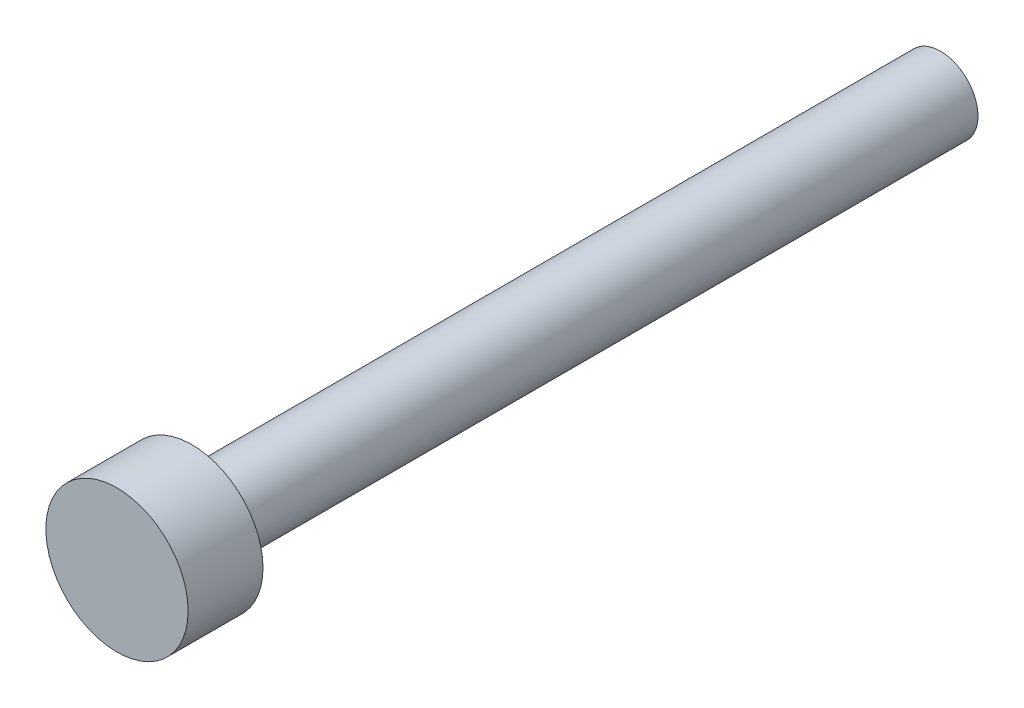
from build123d import *

# Parameters (mm, degrees)
SHANK_NOMINAL_THREAD_ENVELOPE_START     = -20
SHANK_NOMINAL_THREAD_ENVELOPE_PROFILE_R = 1
SHANK_NOMINAL_THREAD_ENVELOPE_DEPTH     = 20
SOCKET_HEAD_ENVELOPE_PROFILE_R          = 1.9
SOCKET_HEAD_ENVELOPE_DEPTH              = 2


with BuildPart() as part:
    # Shank_nominal_thread_envelope_profile → Shank_nominal_thread_envelope (new body)
    with BuildSketch(Plane.XY.offset(SHANK_NOMINAL_THREAD_ENVELOPE_START)):
        Circle(SHANK_NOMINAL_THREAD_ENVELOPE_PROFILE_R)
    extrude(amount=SHANK_NOMINAL_THREAD_ENVELOPE_DEPTH)

    # Socket_head_envelope_profile → Socket_head_envelope (add)
    with BuildSketch(Plane.XY):
        Circle(SOCKET_HEAD_ENVELOPE_PROFILE_R)
    extrude(amount=SOCKET_HEAD_ENVELOPE_DEPTH)


solid = part.part
